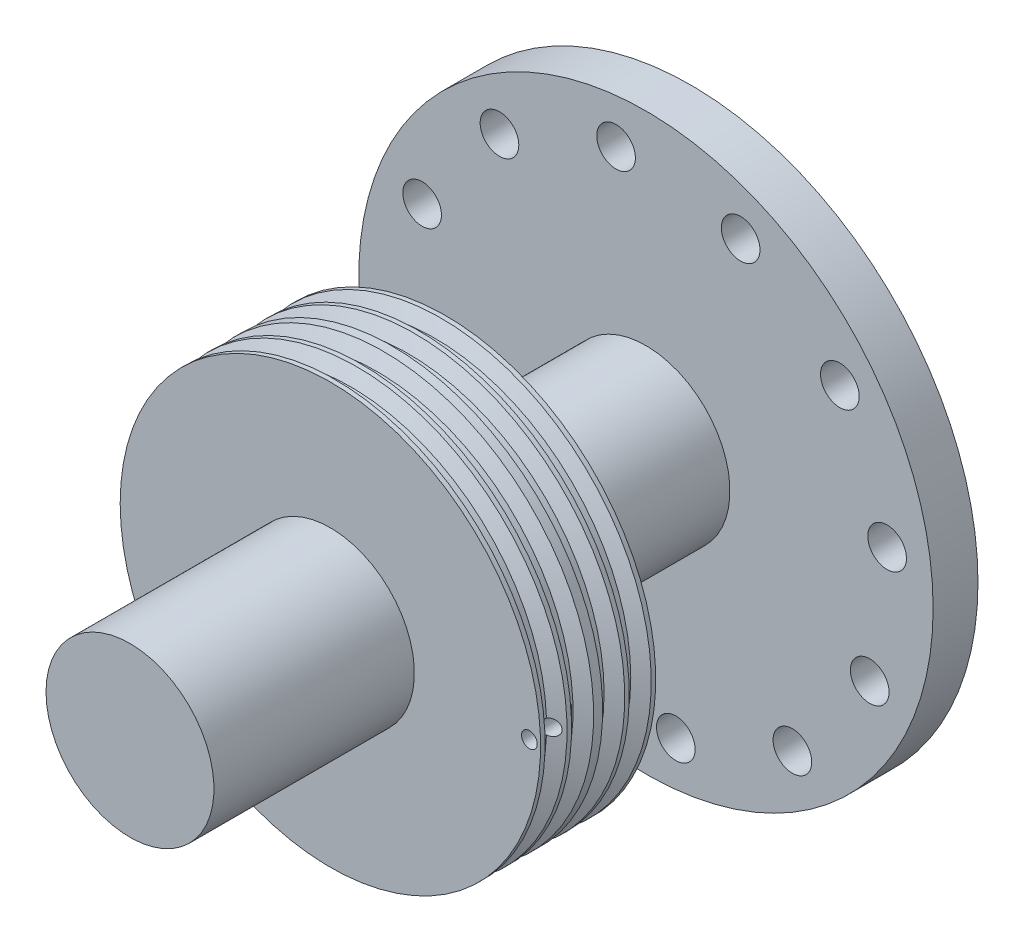
from build123d import *

# Parameters (mm, degrees)
SKETCH1_R           = 25.608746635
BOSS_EXTRUDE3_DEPTH = 4
SKETCH10_R          = 0.7
CUT_EXTRUDE1_DEPTH  = 4
SKETCH11_R          = 0.7
CUT_EXTRUDE2_DEPTH  = 4


with BuildPart() as part:
    # Sketch1 → Boss-Extrude3 (new body)
    with BuildSketch(Plane.XY):
        Circle(SKETCH1_R)
        with BuildLine():
            ThreePointArc((-18.650676838, -12), (-16.231543143, -11.700269066), (-15.931812209, -14.119402761))
            ThreePointArc((-15.931812209, -14.119402761), (-18.350945904, -14.419133695), (-18.650676838, -12))
        make_face(mode=Mode.SUBTRACT)
        with BuildLine():
            ThreePointArc((-9.804238645, -18.895954043), (-7.385104949, -18.596223108), (-7.085374015, -21.015356804))
            ThreePointArc((-7.085374015, -21.015356804), (-9.504507711, -21.315087738), (-9.804238645, -18.895954043))
        make_face(mode=Mode.SUBTRACT)
        with BuildLine():
            ThreePointArc((-22.863940025, -1.604709519), (-20.44480633, -1.304978585), (-20.145075396, -3.72411228))
            ThreePointArc((-20.145075396, -3.72411228), (-22.564209091, -4.023843215), (-22.863940025, -1.604709519))
        make_face(mode=Mode.SUBTRACT)
        with BuildLine():
            ThreePointArc((1.304978585, -20.44480633), (3.72411228, -20.145075396), (4.023843215, -22.564209091))
            ThreePointArc((4.023843215, -22.564209091), (1.604709519, -22.863940025), (1.304978585, -20.44480633))
        make_face(mode=Mode.SUBTRACT)
        with BuildLine():
            ThreePointArc((14.419133695, -18.350945904), (12, -18.650676838), (11.700269066, -16.231543143))
            ThreePointArc((11.700269066, -16.231543143), (14.119402761, -15.931812209), (14.419133695, -18.350945904))
        make_face(mode=Mode.SUBTRACT)
        with BuildLine():
            ThreePointArc((21.315087738, -9.504507711), (18.895954043, -9.804238645), (18.596223108, -7.385104949))
            ThreePointArc((18.596223108, -7.385104949), (21.015356804, -7.085374015), (21.315087738, -9.504507711))
        make_face(mode=Mode.SUBTRACT)
        with BuildLine():
            ThreePointArc((-21.315087738, 9.504507711), (-18.895954043, 9.804238645), (-18.596223108, 7.385104949))
            ThreePointArc((-18.596223108, 7.385104949), (-21.015356804, 7.085374015), (-21.315087738, 9.504507711))
        make_face(mode=Mode.SUBTRACT)
        with BuildLine():
            ThreePointArc((-11.700269066, 16.231543143), (-14.119402761, 15.931812209), (-14.419133695, 18.350945904))
            ThreePointArc((-14.419133695, 18.350945904), (-12, 18.650676838), (-11.700269066, 16.231543143))
        make_face(mode=Mode.SUBTRACT)
        with BuildLine():
            ThreePointArc((-1.304978585, 20.44480633), (-3.72411228, 20.145075396), (-4.023843215, 22.564209091))
            ThreePointArc((-4.023843215, 22.564209091), (-1.604709519, 22.863940025), (-1.304978585, 20.44480633))
        make_face(mode=Mode.SUBTRACT)
        with BuildLine():
            ThreePointArc((20.145075396, 3.72411228), (22.564209091, 4.023843215), (22.863940025, 1.604709519))
            ThreePointArc((22.863940025, 1.604709519), (20.44480633, 1.304978585), (20.145075396, 3.72411228))
        make_face(mode=Mode.SUBTRACT)
        with BuildLine():
            ThreePointArc((9.804238645, 18.895954043), (7.385104949, 18.596223108), (7.085374015, 21.015356804))
            ThreePointArc((7.085374015, 21.015356804), (9.504507711, 21.315087738), (9.804238645, 18.895954043))
        make_face(mode=Mode.SUBTRACT)
        with BuildLine():
            ThreePointArc((18.650676838, 12), (16.231543143, 11.700269066), (15.931812209, 14.119402761))
            ThreePointArc((15.931812209, 14.119402761), (18.350945904, 14.419133695), (18.650676838, 12))
        make_face(mode=Mode.SUBTRACT)
    extrude(amount=BOSS_EXTRUDE3_DEPTH)

    # Sketch9 → Revolve1 (revolve)
    with BuildSketch(Plane(origin=(0, 0, 0), x_dir=(0, 0, -1), z_dir=(1, 0, 0)), mode=Mode.PRIVATE) as revolve1_sk:
        Polygon((-32.13618734, 18.743688774), (-32.13618734, 7.487377548), (-27.00309367, 7.487377548), (-27.00309367, 18.743688774), (-27.40309367, 18.743688774), (-27.98899043, 17.487229118), (-28.78899043, 17.487229118), (-29.37488719, 18.743688774), (-29.77488719, 18.743688774), (-30.355537265, 17.498480669), (-31.155537265, 17.498480669), (-31.73618734, 18.743688774), align=None)
        Polygon((-27.00309367, 18.743688774), (-27.00309367, 7.487377548), (-21.87, 7.487377548), (-21.87, 18.743688774), (-22.27, 18.743688774), (-22.850650075, 17.498480669), (-23.650650075, 17.498480669), (-24.231300151, 18.743688774), (-24.631300151, 18.743688774), (-25.21719691, 17.487229118), (-26.01719691, 17.487229118), (-26.60309367, 18.743688774), align=None)
        Polygon((-32.13618734, 7.487377548), (-50.00618734, 7.487377548), (-50.00618734, 0), (-4, 0), (-4, 7.487377548), (-21.87, 7.487377548), (-27.00309367, 7.487377548), align=None)
    revolve(revolve1_sk.sketch.rotate(Axis((0, 0, 0), (0, 0, 1)), 90), axis=Axis((0, 0, 0), (0, 0, 1)))

    # Sketch10 → Cut-Extrude1 (cut)
    with BuildSketch(Plane.XY.offset(32.13618734)):
        with Locations((17.743688774, 0)):
            Circle(SKETCH10_R)
    extrude(amount=-CUT_EXTRUDE1_DEPTH, mode=Mode.SUBTRACT)

    # Sketch11 → Cut-Extrude2 (cut)
    with BuildSketch(Plane(origin=(0, 0, 21.87), x_dir=(-1, 0, 0), z_dir=(0, 0, -1))):
        with Locations((17.743688774, 0)):
            Circle(SKETCH11_R)
    extrude(amount=-CUT_EXTRUDE2_DEPTH, mode=Mode.SUBTRACT)


solid = part.part
